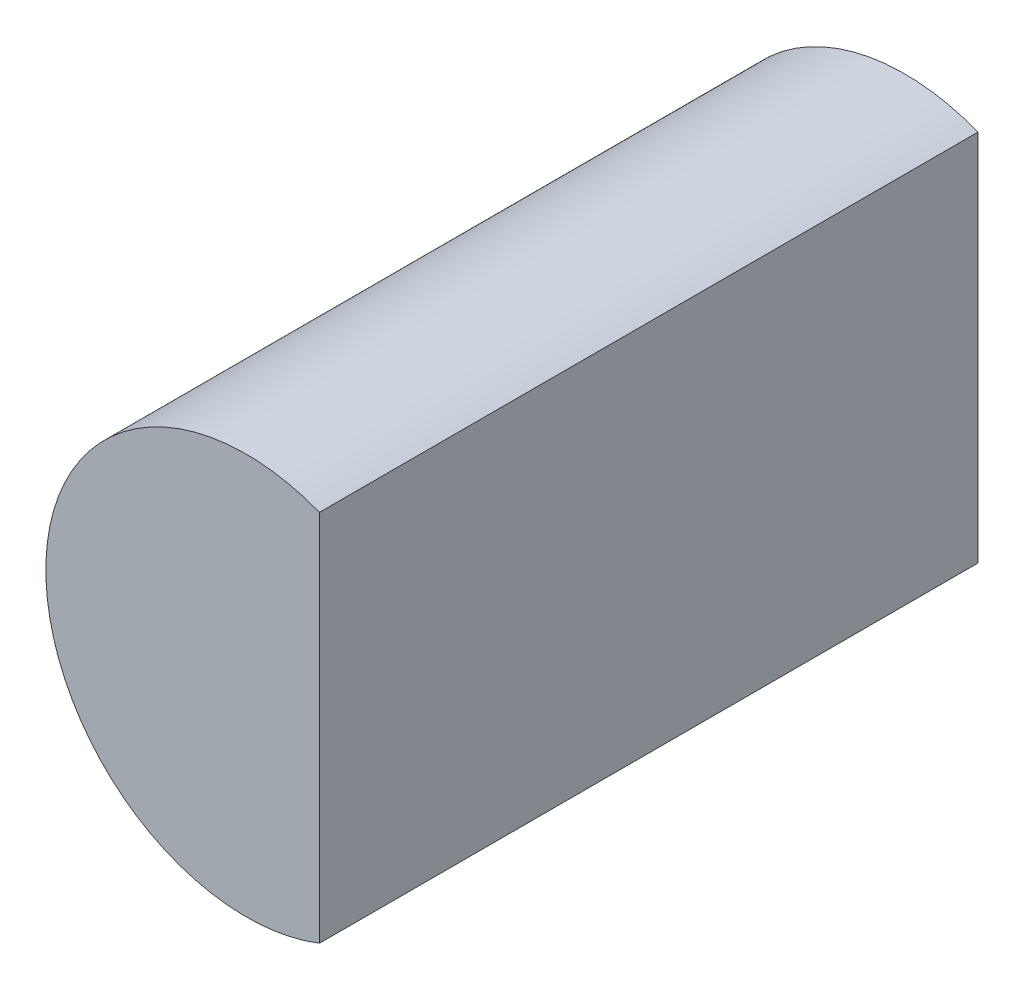
from build123d import *

# Parameters (mm, degrees)
EXTRUDE_1_DEPTH = 18


with BuildPart() as part:
    # 草图1 → 凸台-拉伸1 (new body)
    with BuildSketch(Plane.XY):
        with BuildLine():
            Line((2, -5.1), (2, 5.1))
            ThreePointArc((2, 5.1), (-5.47813837, 0), (2, -5.1))
        make_face()
    extrude(amount=EXTRUDE_1_DEPTH)


solid = part.part
